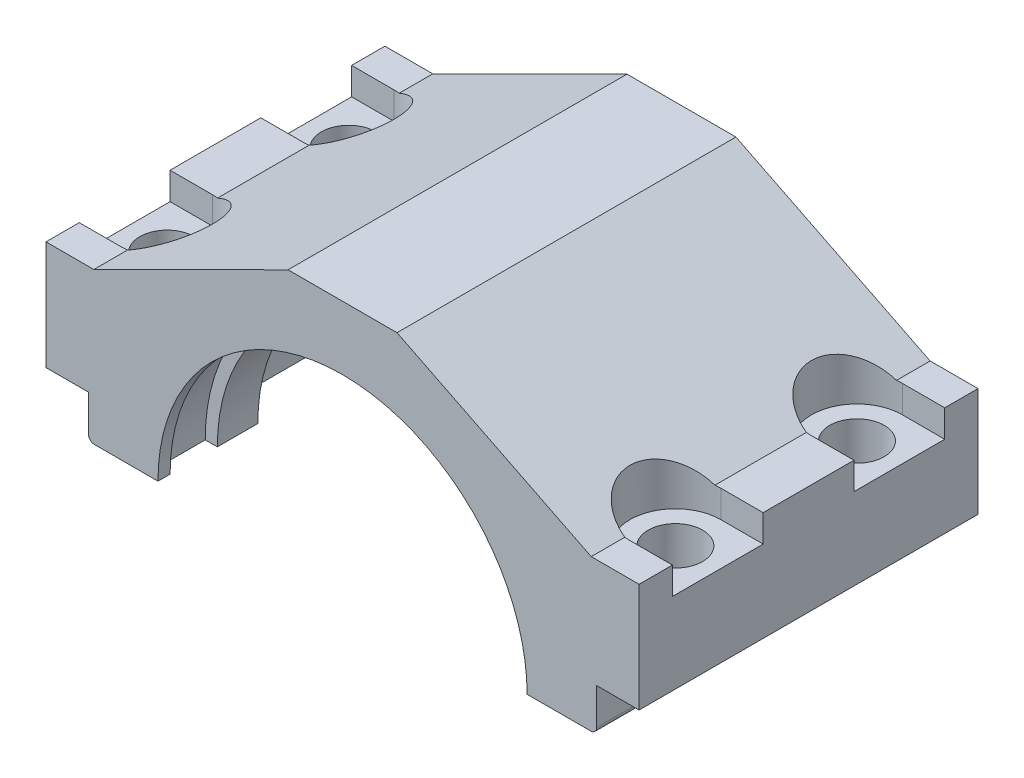
from build123d import *

# Parameters (mm, degrees)
BOSS_EXTRUDE1_DEPTH     = 56
SKETCH2_W               = 2
SKETCH2_H               = 7.81
SKETCH2_W_2             = 5.5
SKETCH2_H_2             = 23
SKETCH2_W_3             = 1.997029369
SKETCH2_H_3             = 9
CUT_EXTRUDE1_DEPTH      = 79.498407627
CUT_EXTRUDE1_DEPTH_BACK = 4.5
SKETCH5_R               = 4.5
CUT_EXTRUDE2_DEPTH      = 78.183223566


with BuildPart() as part:
    # Sketch1 → Boss-Extrude1 (new body)
    with BuildSketch(Plane.XY):
        with BuildLine():
            Line((-30.5, 0), (-41, 0))
            ThreePointArc((-41, 0), (-41.707106781, 0.292893219), (-42, 1))
            Line((-42, 1), (-42, 7))
            Line((-42, 7), (-49, 7))
            Line((-49, 7), (-49, 25))
            Line((-49, 25), (-41.09, 25))
            Line((-41.09, 25), (-9, 41))
            Line((-9, 41), (0, 41))
            Line((0, 41), (0, 30.5))
            ThreePointArc((0, 30.5), (-21.566756826, 21.566756826), (-30.5, 0))
        make_face()
    extrude(amount=-BOSS_EXTRUDE1_DEPTH)

    # Sketch2 → Cut-Revolve6 (revolve, cut)
    with BuildSketch(Plane.XZ):
        with Locations((-31.5, -5.905)):
            Rectangle(SKETCH2_W, SKETCH2_H)
        with Locations((-33.25, -28)):
            Rectangle(SKETCH2_W_2, SKETCH2_H_2)
        with Locations((-31.498514685, -49.5)):
            Rectangle(SKETCH2_W_3, SKETCH2_H_3)
    revolve(axis=Axis((0, 0, 0), (0, 0, -1)), mode=Mode.SUBTRACT)

    # Sketch4 → Cut-Extrude1 (cut, two sides: drawn at the far end of the back side and taken through both)
    with BuildSketch(Plane(origin=(0, 25, 0), x_dir=(1, 0, 0), z_dir=(0, 1, 0)).offset(-CUT_EXTRUDE1_DEPTH_BACK)):
        with BuildLine():
            Line((-49, 50.5), (-42, 50.5))
            ThreePointArc((-42, 50.5), (-34.5, 43), (-42, 35.5))
            Line((-42, 35.5), (-49, 35.5))
            Line((-49, 35.5), (-49, 50.5))
        make_face()
        with BuildLine():
            Line((-49, 20.5), (-42, 20.5))
            ThreePointArc((-42, 20.5), (-34.5, 13), (-42, 5.5))
            Line((-42, 5.5), (-49, 5.5))
            Line((-49, 5.5), (-49, 20.5))
        make_face()
    extrude(amount=CUT_EXTRUDE1_DEPTH + CUT_EXTRUDE1_DEPTH_BACK, mode=Mode.SUBTRACT)

    # Sketch5 → Cut-Extrude2 (cut, through all)
    with BuildSketch(Plane(origin=(0, 20.5, 0), x_dir=(1, 0, 0), z_dir=(0, 1, 0))):
        with Locations(Location((-42, 13, 0), (0, 0, 270))):
            Circle(SKETCH5_R)
        with Locations(Location((-42, 43, 0), (0, 0, 270))):
            Circle(SKETCH5_R)
    extrude(amount=-CUT_EXTRUDE2_DEPTH, mode=Mode.SUBTRACT)

    # Mirror1: part across plane


with BuildPart() as part_1:
    add(part.part)
    add(part.part.mirror(Plane(origin=(0, 41, -56), x_dir=(0, 0, 1), z_dir=(-1, 0, 0))))


solid = part_1.part
